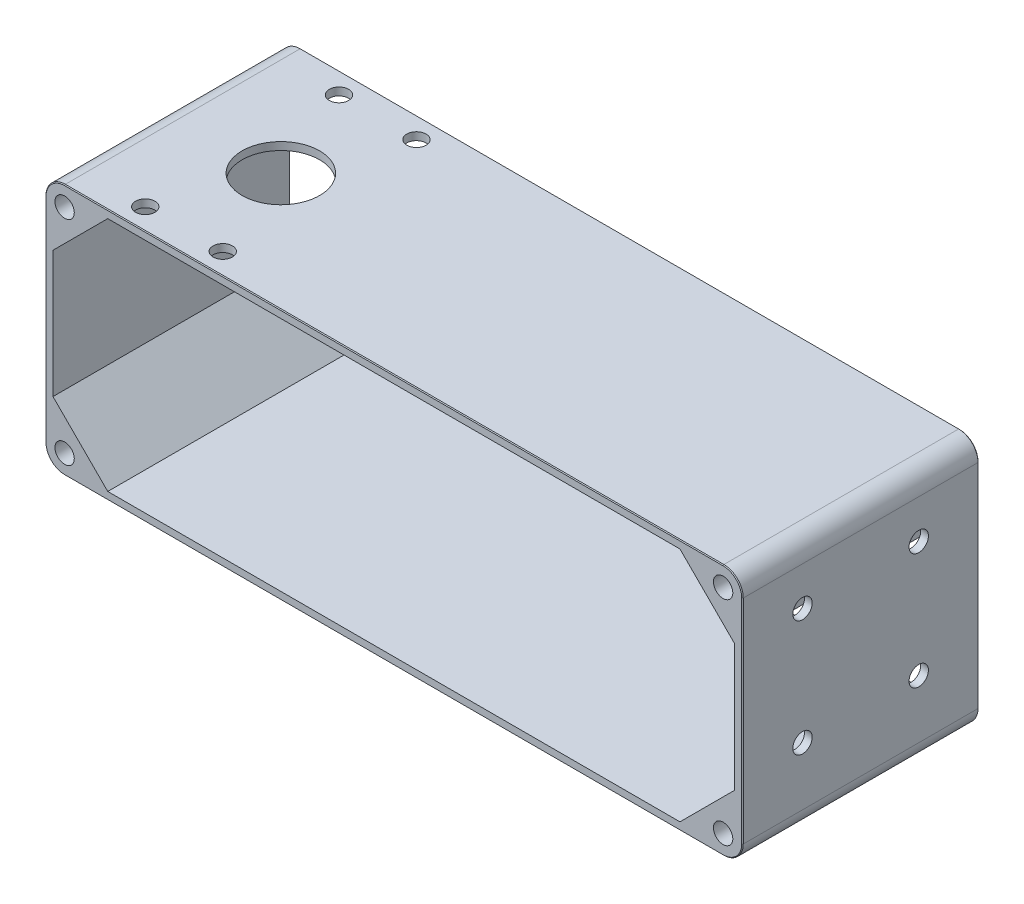
from build123d import *

# Parameters (mm, degrees)
SKETCH3_R               = 3.175
SKETCH3_R_2             = 3.429
BOSS_EXTRUDE1_DEPTH     = 77.47
CHAMFER1_SIZE           = 0.254
CUT_EXTRUDE1_DEPTH      = 145.117023717
CUT_EXTRUDE1_DEPTH_BACK = 145.117023717
SKETCH4_R               = 3.175
SKETCH4_R_2             = 3.429
SKETCH5_R               = 3.175
SKETCH5_R_2             = 12.7
CUT_EXTRUDE2_DEPTH      = 2.54
SKETCH6_R               = 3.175
CUT_EXTRUDE3_DEPTH      = 2.54


with BuildPart() as part:
    # Sketch3 → Boss-Extrude1 (new body)
    with BuildSketch(Plane.XY):
        with BuildLine():
            Line((107.95, -41.275), (-107.95, -41.275))
            ThreePointArc((-107.95, -41.275), (-112.440128061, -39.415128061), (-114.3, -34.925))
            Line((-114.3, -34.925), (-114.3, 34.925))
            ThreePointArc((-114.3, 34.925), (-112.440128061, 39.415128061), (-107.95, 41.275))
            Line((-107.95, 41.275), (107.95, 41.275))
            ThreePointArc((107.95, 41.275), (112.440128061, 39.415128061), (114.3, 34.925))
            Line((114.3, 34.925), (114.3, -34.925))
            ThreePointArc((114.3, -34.925), (112.440128061, -39.415128061), (107.95, -41.275))
        make_face()
        with Locations((-107.95, 34.925)):
            Circle(SKETCH3_R, mode=Mode.SUBTRACT)
        with Locations((-107.95, -34.925)):
            Circle(SKETCH3_R, mode=Mode.SUBTRACT)
        with Locations((107.95, -34.925)):
            Circle(SKETCH3_R, mode=Mode.SUBTRACT)
        with Locations((107.95, 34.925)):
            Circle(SKETCH3_R, mode=Mode.SUBTRACT)
        with Locations((-85.598, 0)):
            Circle(SKETCH3_R_2, mode=Mode.SUBTRACT)
        with Locations((85.598, 0)):
            Circle(SKETCH3_R_2, mode=Mode.SUBTRACT)
        with Locations((-15.875, 5.732638889)):
            Circle(SKETCH3_R, mode=Mode.SUBTRACT)
        with Locations((15.875, 5.732638889)):
            Circle(SKETCH3_R, mode=Mode.SUBTRACT)
        with Locations((15.875, -5.732638889)):
            Circle(SKETCH3_R, mode=Mode.SUBTRACT)
        with Locations((-15.875, -5.732638889)):
            Circle(SKETCH3_R, mode=Mode.SUBTRACT)
    extrude(amount=BOSS_EXTRUDE1_DEPTH)

    # Chamfer1
    chamfer1_edges = [part.edges().sort_by_distance(p)[0] for p in [
        (-112.440128061, 39.415128061, 77.47),
        (0, 41.275, 0),
        (112.440128061, 39.415128061, 0),
        (-114.3, 0, 77.47),
        (-112.440128061, -39.415128061, 77.47),
        (0, -41.275, 77.47),
        (112.440128061, -39.415128061, 77.47),
        (114.3, 0, 77.47),
        (112.440128061, 39.415128061, 77.47),
        (0, 41.275, 77.47),
        (114.3, 0, 0),
        (112.440128061, -39.415128061, 0),
        (0, -41.275, 0),
        (-112.440128061, -39.415128061, 0),
        (-114.3, 0, 0),
        (-112.440128061, 39.415128061, 0),
    ]]
    chamfer(chamfer1_edges, length=CHAMFER1_SIZE)

    # Sketch4 → Cut-Extrude1 (cut, two sides: drawn at the far end of the back side and taken through both)
    with BuildSketch(Plane.XY.offset(77.47).offset(-CUT_EXTRUDE1_DEPTH_BACK)):
        Polygon((111.76, 20.774487758), (93.799487758, 38.735), (-93.799487758, 38.735), (-111.76, 20.774487758), (-111.76, -20.774487758), (-93.799487758, -38.735), (93.799487758, -38.735), (111.76, -20.774487758), align=None)
        with Locations((-15.875, -5.732638889)):
            Circle(SKETCH4_R, mode=Mode.SUBTRACT)
        with Locations((15.875, -5.732638889)):
            Circle(SKETCH4_R, mode=Mode.SUBTRACT)
        with Locations((-85.598, 0)):
            Circle(SKETCH4_R_2, mode=Mode.SUBTRACT)
        with Locations((-15.875, 5.732638889)):
            Circle(SKETCH4_R, mode=Mode.SUBTRACT)
        with Locations((15.875, 5.732638889)):
            Circle(SKETCH4_R, mode=Mode.SUBTRACT)
        with Locations((85.598, 0)):
            Circle(SKETCH4_R_2, mode=Mode.SUBTRACT)
    extrude(amount=CUT_EXTRUDE1_DEPTH + CUT_EXTRUDE1_DEPTH_BACK, mode=Mode.SUBTRACT)

    # Sketch5 → Cut-Extrude2 (cut)
    with BuildSketch(Plane(origin=(0, 41.275, 0), x_dir=(1, 0, 0), z_dir=(0, 1, 0))):
        with Locations(Location((-88.483606557, -6.985, 0), (0, 0, 180))):
            Circle(SKETCH5_R)
        with Locations(Location((-63.083606557, -6.985, 0), (0, 0, 180))):
            Circle(SKETCH5_R)
        with Locations(Location((-63.083606557, -70.485, 0), (0, 0, 180))):
            Circle(SKETCH5_R)
        with Locations(Location((-88.483606557, -70.485, 0), (0, 0, 180))):
            Circle(SKETCH5_R)
        with Locations(Location((-75.783606557, -38.735, 0), (0, 0, 180))):
            Circle(SKETCH5_R_2)
    extrude(amount=-CUT_EXTRUDE2_DEPTH, mode=Mode.SUBTRACT)

    # Sketch6 → Cut-Extrude3 (cut)
    with BuildSketch(Plane(origin=(114.3, 0, 0), x_dir=(0, 0, -1), z_dir=(1, 0, 0))):
        with Locations((-57.785, 22.225)):
            Circle(SKETCH6_R)
        with Locations((-19.685, 22.225)):
            Circle(SKETCH6_R)
        with Locations((-19.685, -15.875)):
            Circle(SKETCH6_R)
        with Locations((-57.785, -15.875)):
            Circle(SKETCH6_R)
    extrude(amount=-CUT_EXTRUDE3_DEPTH, mode=Mode.SUBTRACT)


solid = part.part
